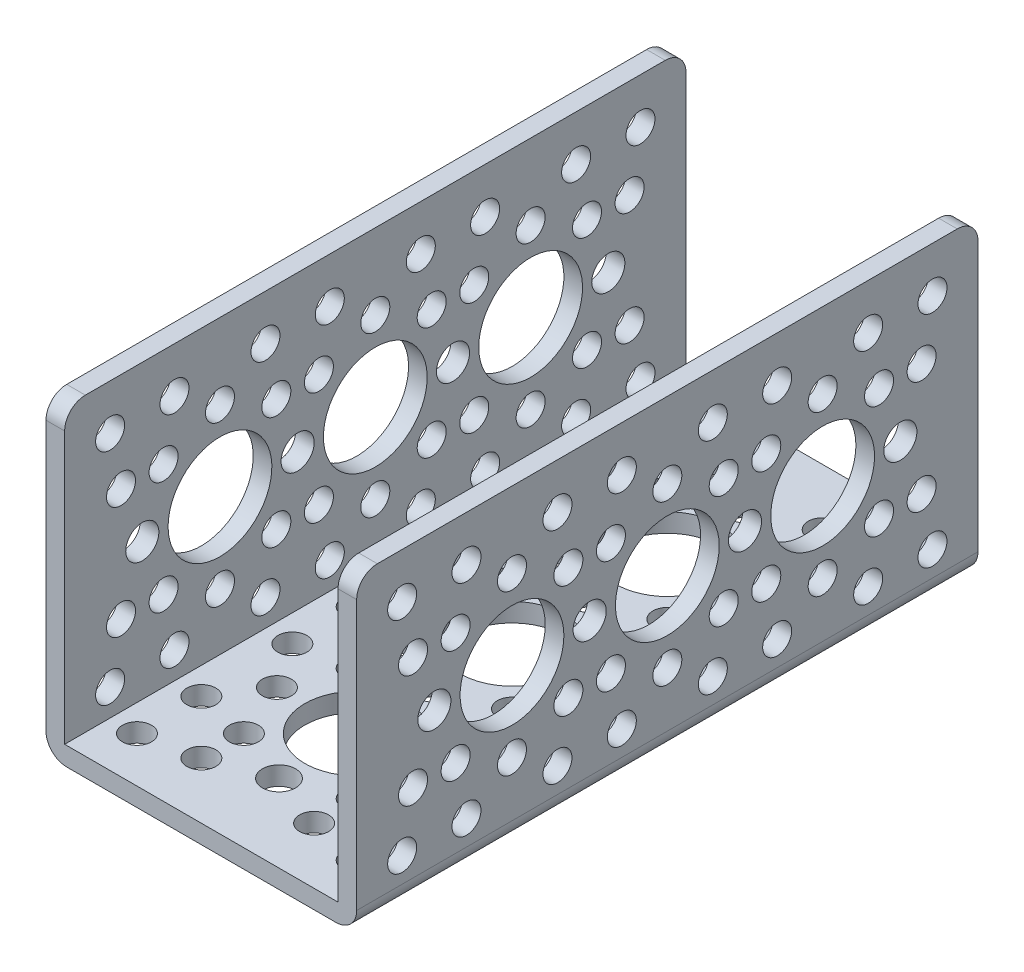
from build123d import *

# Parameters (mm, degrees)
SKETCH1_W                 = 38.1
SKETCH1_H                 = 76.2
BOSS_EXTRUDE1_DEPTH       = 38.1
SKETCH2_W                 = 33.528
SKETCH2_H                 = 35.814
CUT_EXTRUDE1_DEPTH        = 94.3255592
HOLE1_D                   = 12.7254
HOLE1_DEPTH               = 2.286
F_5_CLEARANCE_HOLE1_D     = 3.556
F_5_CLEARANCE_HOLE1_DEPTH = 2.286
F_6_CLEARANCE_HOLE1_D     = 4.064
F_6_CLEARANCE_HOLE1_DEPTH = 2.286
HOLE2_D                   = 12.7254
HOLE2_DEPTH               = 38.1
F_6_CLEARANCE_HOLE2_D     = 4.064
F_6_CLEARANCE_HOLE2_DEPTH = 38.1
F_5_CLEARANCE_HOLE2_D     = 3.556
F_5_CLEARANCE_HOLE2_DEPTH = 38.1
HOLE3_D                   = 12.7254
HOLE3_DEPTH               = 38.1
F_5_CLEARANCE_HOLE3_D     = 3.556
F_5_CLEARANCE_HOLE3_DEPTH = 38.1
F_6_CLEARANCE_HOLE3_D     = 4.064
F_6_CLEARANCE_HOLE3_DEPTH = 38.1
FILLET1_R                 = 2.54


with BuildPart() as part:
    # Sketch1 → Boss-Extrude1 (new body)
    with BuildSketch(Plane.XZ):
        with Locations((19.05, 38.1)):
            Rectangle(SKETCH1_W, SKETCH1_H)
    extrude(amount=-BOSS_EXTRUDE1_DEPTH)

    # Sketch2 → Cut-Extrude1 (cut, through all)
    with BuildSketch(Plane.XY.offset(76.2)):
        with Locations((19.05, 20.193)):
            Rectangle(SKETCH2_W, SKETCH2_H)
    extrude(amount=-CUT_EXTRUDE1_DEPTH, mode=Mode.SUBTRACT)

    # Hole1
    with Locations(Plane(origin=(38.1, 0, 0), x_dir=(0, 0, -1), z_dir=(1, 0, 0))):
        with Locations((-38.1, 19.05), (-19.05, 19.05), (-57.15, 19.05)):
            Hole(HOLE1_D / 2, depth=HOLE1_DEPTH)

    # #5 Clearance Hole1
    with Locations(Plane(origin=(38.1, 0, 0), x_dir=(0, 0, -1), z_dir=(1, 0, 0))):
        with Locations((-62.729615818, 5.579615818), (-69.285202787, 12.135202787), (-62.729615818, 32.520384182), (-69.285202787, 25.964797213), (-13.470384182, 5.579615818), (-6.914797213, 12.135202787), (-13.470384182, 32.520384182), (-6.914797213, 25.964797213), (-43.679615818, 5.579615818), (-24.629615818, 5.579615818), (-43.679615818, 32.520384182), (-24.629615818, 32.520384182), (-70.620384182, 5.579615818), (-70.620384182, 32.520384182), (-51.570384182, 5.579615818), (-51.570384182, 32.520384182), (-50.235202787, 12.135202787), (-57.15, 9.271), (-64.064797213, 12.135202787), (-64.064797213, 25.964797213), (-57.15, 28.829), (-31.185202787, 12.135202787), (-38.1, 9.271), (-45.014797213, 12.135202787), (-45.014797213, 25.964797213), (-38.1, 28.829), (-50.235202787, 25.964797213), (-31.185202787, 25.964797213), (-32.520384182, 5.579615818), (-32.520384182, 32.520384182), (-5.579615818, 5.579615818), (-5.579615818, 32.520384182), (-12.135202787, 12.135202787), (-19.05, 9.271), (-25.964797213, 12.135202787), (-25.964797213, 25.964797213), (-19.05, 28.829), (-12.135202787, 25.964797213)):
            Hole(F_5_CLEARANCE_HOLE1_D / 2, depth=F_5_CLEARANCE_HOLE1_DEPTH)

    # #6 Clearance Hole1
    with Locations(Plane(origin=(38.1, 0, 0), x_dir=(0, 0, -1), z_dir=(1, 0, 0))):
        with Locations((-66.675, 19.05), (-47.625, 19.05), (-28.575, 19.05), (-9.525, 19.05)):
            Hole(F_6_CLEARANCE_HOLE1_D / 2, depth=F_6_CLEARANCE_HOLE1_DEPTH)

    # Hole2
    with Locations(Plane(origin=(0, 0, 0), x_dir=(-1, 0, 0), z_dir=(0, -1, 0))):
        with Locations((-19.05, -57.15), (-19.05, -38.1), (-19.05, -19.05)):
            Hole(HOLE2_D / 2, depth=HOLE2_DEPTH)

    # #6 Clearance Hole2
    with Locations(Plane(origin=(0, 0, 0), x_dir=(-1, 0, 0), z_dir=(0, -1, 0))):
        with Locations((-19.05, -66.675), (-19.05, -47.625), (-19.05, -28.575), (-19.05, -9.525)):
            Hole(F_6_CLEARANCE_HOLE2_D / 2, depth=F_6_CLEARANCE_HOLE2_DEPTH)

    # #5 Clearance Hole2
    with Locations(Plane(origin=(0, 0, 0), x_dir=(-1, 0, 0), z_dir=(0, -1, 0))):
        with Locations((-5.579615818, -70.620384182), (-5.579615818, -62.729615818), (-12.135202787, -69.285202787), (-32.520384182, -70.620384182), (-32.520384182, -62.729615818), (-25.964797213, -69.285202787), (-5.579615818, -51.570384182), (-5.579615818, -43.679615818), (-32.520384182, -51.570384182), (-32.520384182, -43.679615818), (-12.135202787, -50.235202787), (-9.271, -57.15), (-12.135202787, -64.064797213), (-25.964797213, -64.064797213), (-28.829, -57.15), (-25.964797213, -50.235202787), (-9.271, -38.1), (-12.135202787, -45.014797213), (-25.964797213, -45.014797213), (-28.829, -38.1), (-5.579615818, -32.520384182), (-5.579615818, -24.629615818), (-12.135202787, -31.185202787), (-32.520384182, -32.520384182), (-32.520384182, -24.629615818), (-25.964797213, -31.185202787), (-5.579615818, -5.579615818), (-5.579615818, -13.470384182), (-12.135202787, -6.914797213), (-32.520384182, -5.579615818), (-32.520384182, -13.470384182), (-25.964797213, -6.914797213), (-12.135202787, -12.135202787), (-9.271, -19.05), (-12.135202787, -25.964797213), (-25.964797213, -25.964797213), (-28.829, -19.05), (-25.964797213, -12.135202787)):
            Hole(F_5_CLEARANCE_HOLE2_D / 2, depth=F_5_CLEARANCE_HOLE2_DEPTH)

    # Hole3
    with Locations(Plane.ZY):
        with Locations((38.1, 19.05), (19.05, 19.05), (57.15, 19.05)):
            Hole(HOLE3_D / 2, depth=HOLE3_DEPTH)

    # #5 Clearance Hole3
    with Locations(Plane.ZY):
        with Locations((62.729615818, 5.579615818), (69.285202787, 12.135202787), (62.729615818, 32.520384182), (69.285202787, 25.964797213), (13.470384182, 5.579615818), (6.914797213, 12.135202787), (13.470384182, 32.520384182), (6.914797213, 25.964797213), (43.679615818, 5.579615818), (24.629615818, 5.579615818), (43.679615818, 32.520384182), (24.629615818, 32.520384182), (70.620384182, 5.579615818), (70.620384182, 32.520384182), (51.570384182, 5.579615818), (51.570384182, 32.520384182), (50.235202787, 12.135202787), (57.15, 9.271), (64.064797213, 12.135202787), (64.064797213, 25.964797213), (57.15, 28.829), (31.185202787, 12.135202787), (38.1, 9.271), (45.014797213, 12.135202787), (45.014797213, 25.964797213), (38.1, 28.829), (50.235202787, 25.964797213), (31.185202787, 25.964797213), (32.520384182, 5.579615818), (32.520384182, 32.520384182), (5.579615818, 5.579615818), (5.579615818, 32.520384182), (12.135202787, 12.135202787), (19.05, 9.271), (25.964797213, 12.135202787), (25.964797213, 25.964797213), (19.05, 28.829), (12.135202787, 25.964797213)):
            Hole(F_5_CLEARANCE_HOLE3_D / 2, depth=F_5_CLEARANCE_HOLE3_DEPTH)

    # #6 Clearance Hole3
    with Locations(Plane.ZY):
        with Locations((66.675, 19.05), (47.625, 19.05), (28.575, 19.05), (9.525, 19.05)):
            Hole(F_6_CLEARANCE_HOLE3_D / 2, depth=F_6_CLEARANCE_HOLE3_DEPTH)

    # Fillet1
    fillet1_edges = [part.edges().sort_by_distance(p)[0] for p in [
        (1.143, 38.1, 0),
        (36.957, 38.1, 0),
        (1.143, 38.1, 76.2),
        (0, 0, 38.1),
        (38.1, 0, 38.1),
        (36.957, 38.1, 76.2),
    ]]
    fillet(fillet1_edges, radius=FILLET1_R)


solid = part.part
